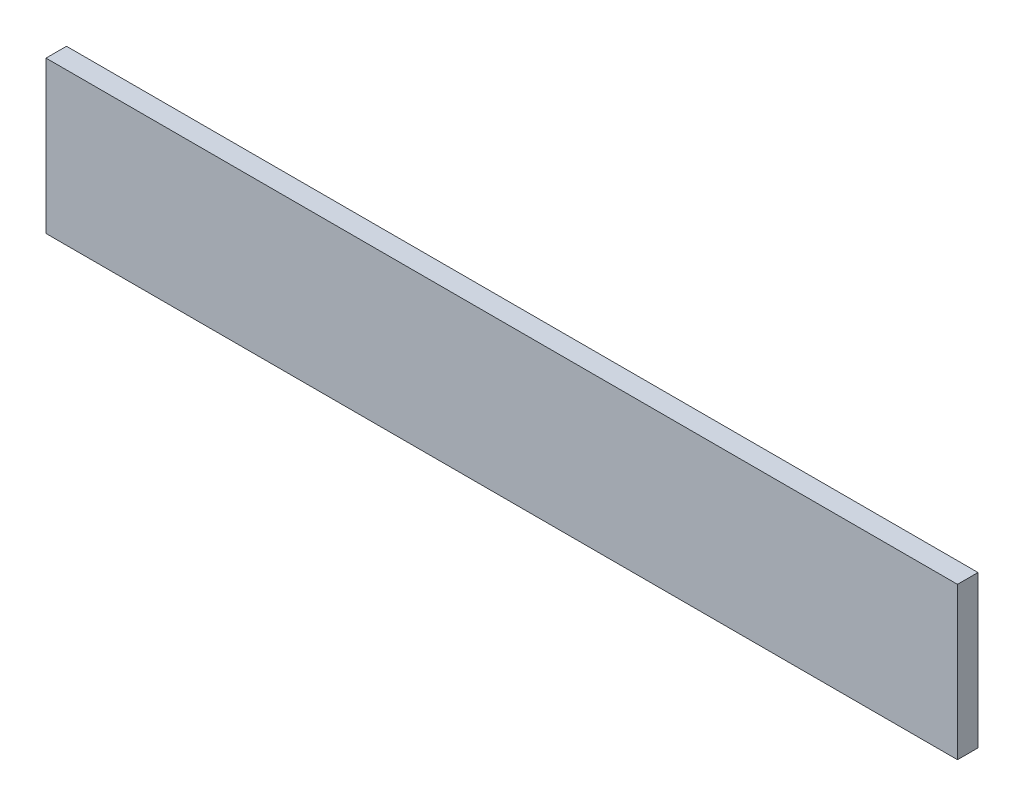
from build123d import *

# Parameters (mm, degrees)
ESQUISSE1_W        = 1200
ESQUISSE1_H        = 200
BOSS_EXTRU_1_DEPTH = 27


with BuildPart() as part:
    # Esquisse1 → Boss.-Extru.1 (new body)
    with BuildSketch(Plane.XY):
        with Locations((600, 100)):
            Rectangle(ESQUISSE1_W, ESQUISSE1_H)
    extrude(amount=BOSS_EXTRU_1_DEPTH)


solid = part.part
